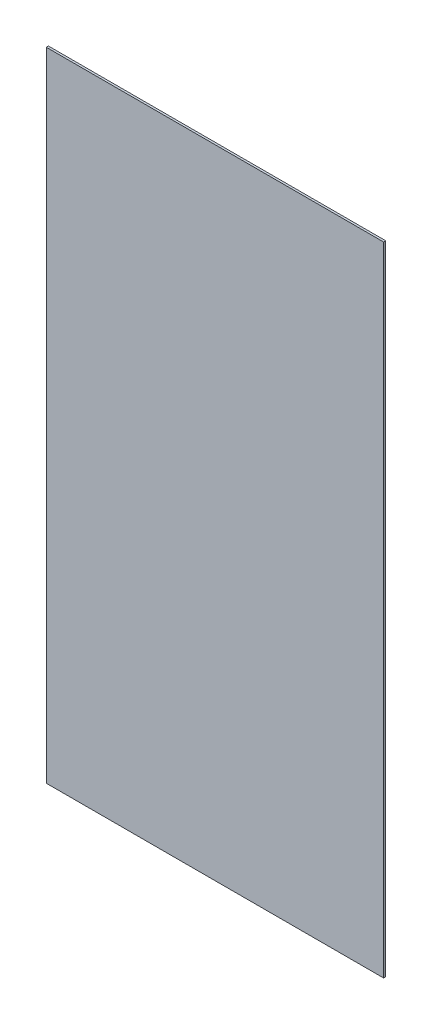
from build123d import *

# Parameters (mm, degrees)
SKETCH1_W           = 635
SKETCH1_H           = 1200
BOSS_EXTRUDE1_DEPTH = 4


with BuildPart() as part:
    # Sketch1 → Boss-Extrude1 (new body)
    with BuildSketch(Plane.XY):
        Rectangle(SKETCH1_W, SKETCH1_H)
    extrude(amount=BOSS_EXTRUDE1_DEPTH)


solid = part.part
